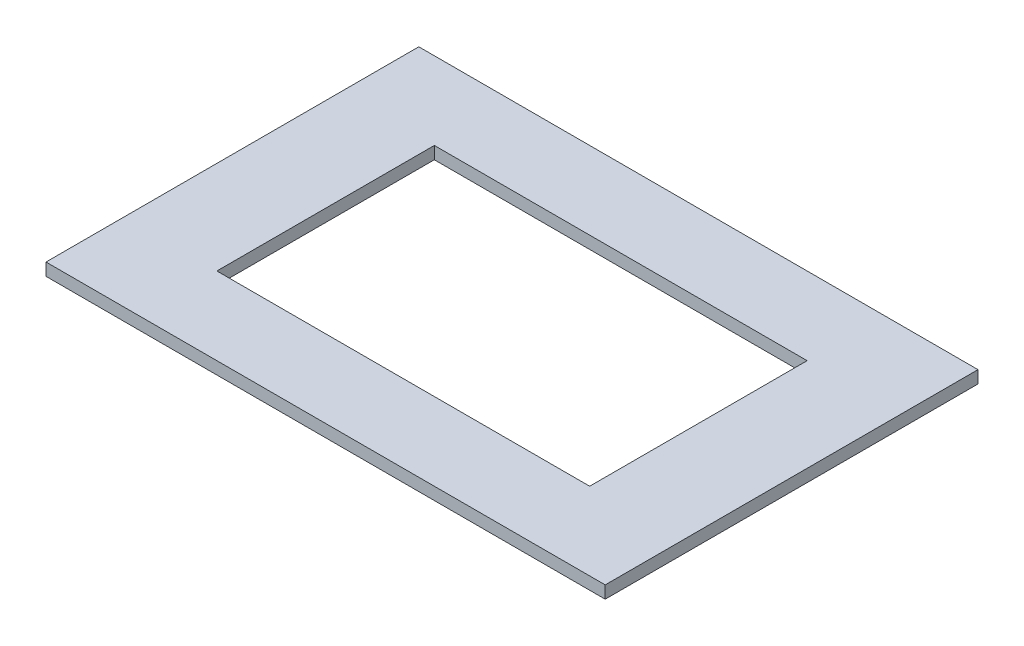
from build123d import *

# Parameters (mm, degrees)
ESBO_O1_W                = 270
ESBO_O1_H                = 180
ESBO_O1_W_2              = 180
ESBO_O1_H_2              = 105
RESSALTO_EXTRUS_O1_DEPTH = 6


with BuildPart() as part:
    # Esboço1 → Ressalto-extrusão1 (new body)
    with BuildSketch(Plane(origin=(0, 0, 0), x_dir=(1, 0, 0), z_dir=(0, 1, 0))):
        with Locations((135, 90)):
            Rectangle(ESBO_O1_W, ESBO_O1_H)
        with Locations((135, 90)):
            Rectangle(ESBO_O1_W_2, ESBO_O1_H_2, mode=Mode.SUBTRACT)
    extrude(amount=RESSALTO_EXTRUS_O1_DEPTH)


solid = part.part
